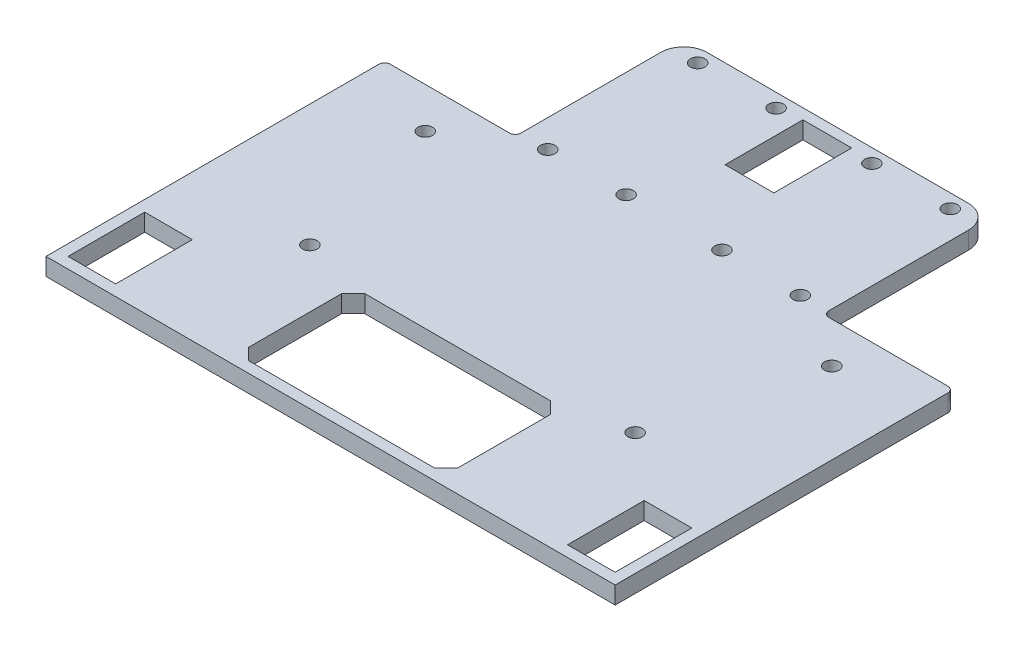
from build123d import *

# Parameters (mm, degrees)
SKETCH_1_R      = 1.25
SKETCH_1_W      = 8.2
SKETCH_1_H      = 13.2
SKETCH_1_W_2    = 8.4
SKETCH_1_H_2    = 13.4
EXTRUDE_1_DEPTH = 3


with BuildPart() as part:
    # Эскиз1 → Бобышка-Вытянуть1 (new body)
    with BuildSketch(Plane(origin=(0, 0, 0), x_dir=(1, 0, 0), z_dir=(0, 1, 0))):
        with BuildLine():
            Line((-49, 10.671781602), (-49, 67.966339104))
            ThreePointArc((-49, 67.966339104), (-48.707106781, 68.673445885), (-48, 68.966339104))
            Line((-48, 68.966339104), (-27.5, 68.966339104))
            ThreePointArc((-27.5, 68.966339104), (-26.792893219, 69.259232322), (-26.5, 69.966339104))
            Line((-26.5, 69.966339104), (-26.5, 94))
            ThreePointArc((-26.5, 94), (-25.328427125, 96.828427125), (-22.5, 98))
            Line((-22.5, 98), (22.5, 98))
            ThreePointArc((22.5, 98), (25.328427125, 96.828427125), (26.5, 94))
            Line((26.5, 94), (26.5, 69.966339104))
            ThreePointArc((26.5, 69.966339104), (26.792893219, 69.259232322), (27.5, 68.966339104))
            Line((27.5, 68.966339104), (48, 68.966339104))
            ThreePointArc((48, 68.966339104), (48.707106781, 68.673445885), (49, 67.966339104))
            Line((49, 67.966339104), (49, 10.671781602))
            Line((49, 10.671781602), (-49, 10.671781602))
        make_face()
        with Locations(Location((-21.75, 95.624367377, 0), (0, 0, 270))):
            Circle(SKETCH_1_R, mode=Mode.SUBTRACT)
        with Locations(Location((-8.25, 95.624367377, 0), (0, 0, 270))):
            Circle(SKETCH_1_R, mode=Mode.SUBTRACT)
        with Locations(Location((8.25, 95.624367377, 0), (0, 0, 270))):
            Circle(SKETCH_1_R, mode=Mode.SUBTRACT)
        with Locations(Location((21.75, 95.624367377, 0), (0, 0, 270))):
            Circle(SKETCH_1_R, mode=Mode.SUBTRACT)
        with Locations(Location((21.75, 69.808310831, 0), (0, 0, 270))):
            Circle(SKETCH_1_R, mode=Mode.SUBTRACT)
        with Locations(Location((8.25, 69.808310831, 0), (0, 0, 270))):
            Circle(SKETCH_1_R, mode=Mode.SUBTRACT)
        with Locations(Location((-8.25, 69.808310831, 0), (0, 0, 270))):
            Circle(SKETCH_1_R, mode=Mode.SUBTRACT)
        with Locations(Location((-21.75, 69.808310831, 0), (0, 0, 270))):
            Circle(SKETCH_1_R, mode=Mode.SUBTRACT)
        with Locations(Location((-35, 61.966339104, 0), (0, 0, 270))):
            Circle(SKETCH_1_R, mode=Mode.SUBTRACT)
        with Locations(Location((-28, 35.111011166, 0), (0, 0, 270))):
            Circle(SKETCH_1_R, mode=Mode.SUBTRACT)
        with Locations(Location((28, 35.111011166, 0), (0, 0, 270))):
            Circle(SKETCH_1_R, mode=Mode.SUBTRACT)
        with Locations(Location((35, 61.966339104, 0), (0, 0, 270))):
            Circle(SKETCH_1_R, mode=Mode.SUBTRACT)
        with Locations((-43, 19.167635493)):
            Rectangle(SKETCH_1_W, SKETCH_1_H, mode=Mode.SUBTRACT)
        with Locations((43, 19.167635493)):
            Rectangle(SKETCH_1_W, SKETCH_1_H, mode=Mode.SUBTRACT)
        with Locations((0, 89.5)):
            Rectangle(SKETCH_1_W_2, SKETCH_1_H_2, mode=Mode.SUBTRACT)
        Polygon((16, 12.567635493), (-16, 12.567635493), (-18, 14.567635493), (-18, 30.567635493), (-16, 32.567635493), (16, 32.567635493), (18, 30.567635493), (18, 14.567635493), align=None, mode=Mode.SUBTRACT)
    extrude(amount=EXTRUDE_1_DEPTH)


solid = part.part
